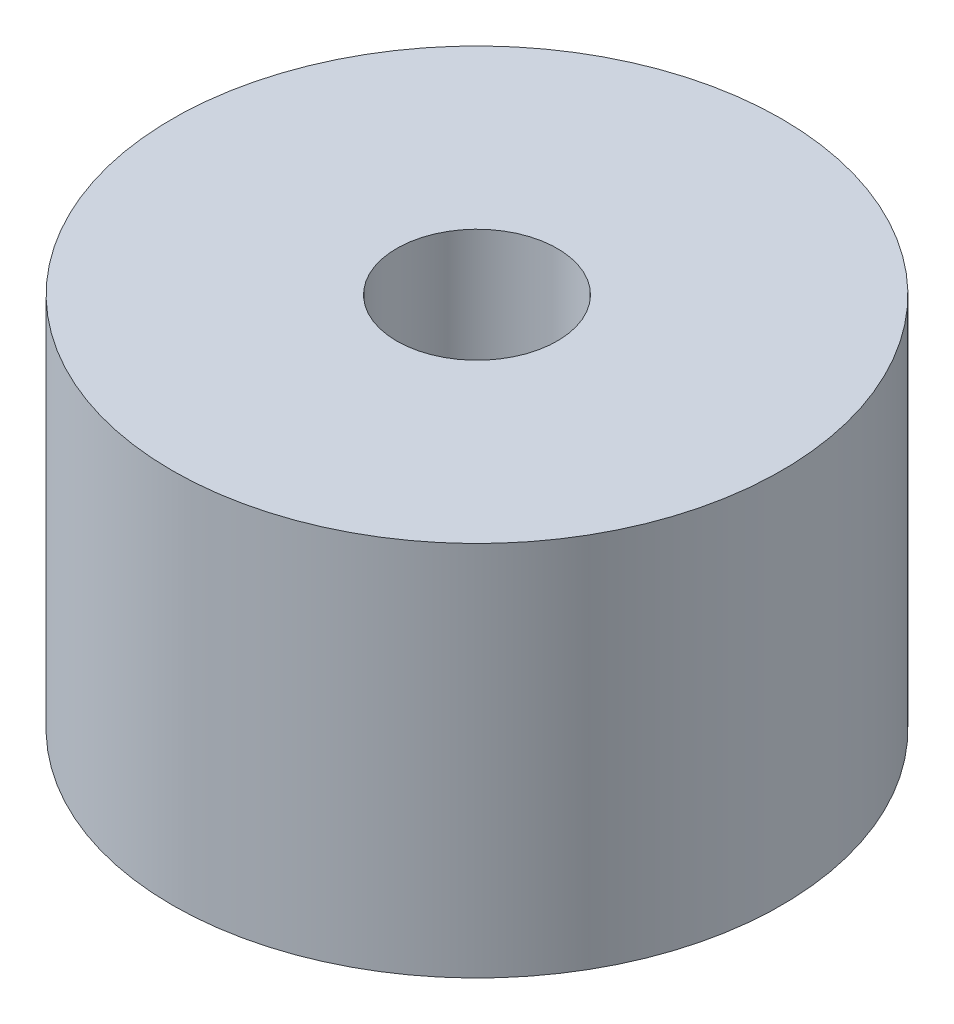
from build123d import *

# Parameters (mm, degrees)
SKETCH1_R           = 8.825
SKETCH1_R_2         = 2.325
BOSS_EXTRUDE1_DEPTH = 10.9


with BuildPart() as part:
    # Sketch1 → Boss-Extrude1 (new body)
    with BuildSketch(Plane(origin=(0, 0, 0), x_dir=(1, 0, 0), z_dir=(0, 1, 0))):
        with Locations(Location((0, 0, 0), (0, 0, 270))):
            Circle(SKETCH1_R)
        with Locations(Location((0, 0, 0), (0, 0, 270))):
            Circle(SKETCH1_R_2, mode=Mode.SUBTRACT)
    extrude(amount=BOSS_EXTRUDE1_DEPTH)


solid = part.part
